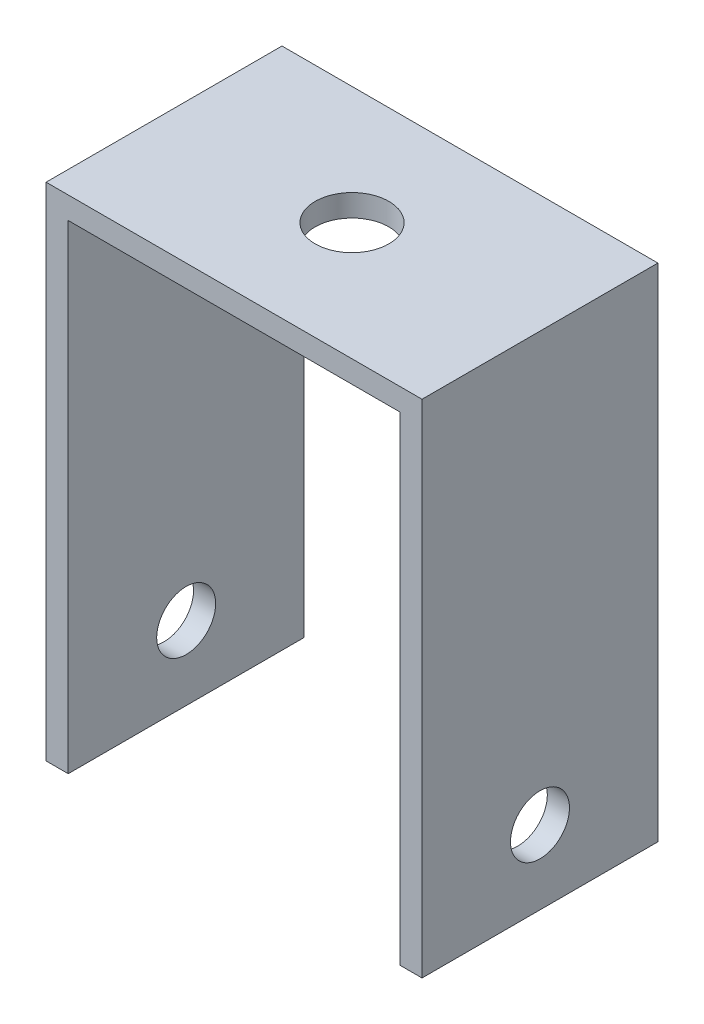
from build123d import *

# Parameters (mm, degrees)
BOSS_EXTRUDE1_DEPTH = 16
SKETCH2_R           = 4
CUT_EXTRUDE1_DEPTH  = 87.492774265
SKETCH3_R           = 5
CUT_EXTRUDE2_DEPTH  = 32


with BuildPart() as part:
    # Sketch1 → Boss-Extrude1 (new, symmetric)
    with BuildSketch(Plane.XY):
        Polygon((-22.5, 0), (-22.5, 65), (22.5, 65), (22.5, 0), (25.5, 0), (25.5, 68), (-25.5, 68), (-25.5, 0), align=None)
    extrude(amount=BOSS_EXTRUDE1_DEPTH, both=True)

    # Sketch2 → Cut-Extrude1 (cut, through all)
    with BuildSketch(Plane(origin=(25.5, 0, 0), x_dir=(0, 0, -1), z_dir=(1, 0, 0))):
        with Locations((0, 10)):
            Circle(SKETCH2_R)
    extrude(amount=-CUT_EXTRUDE1_DEPTH, mode=Mode.SUBTRACT)

    # Sketch3 → Cut-Extrude2 (cut)
    with BuildSketch(Plane(origin=(0, 68, 0), x_dir=(1, 0, 0), z_dir=(0, 1, 0))):
        with Locations(Location((0, 0, 0), (0, 0, 270))):
            Circle(SKETCH3_R)
    extrude(amount=-CUT_EXTRUDE2_DEPTH, mode=Mode.SUBTRACT)


solid = part.part
